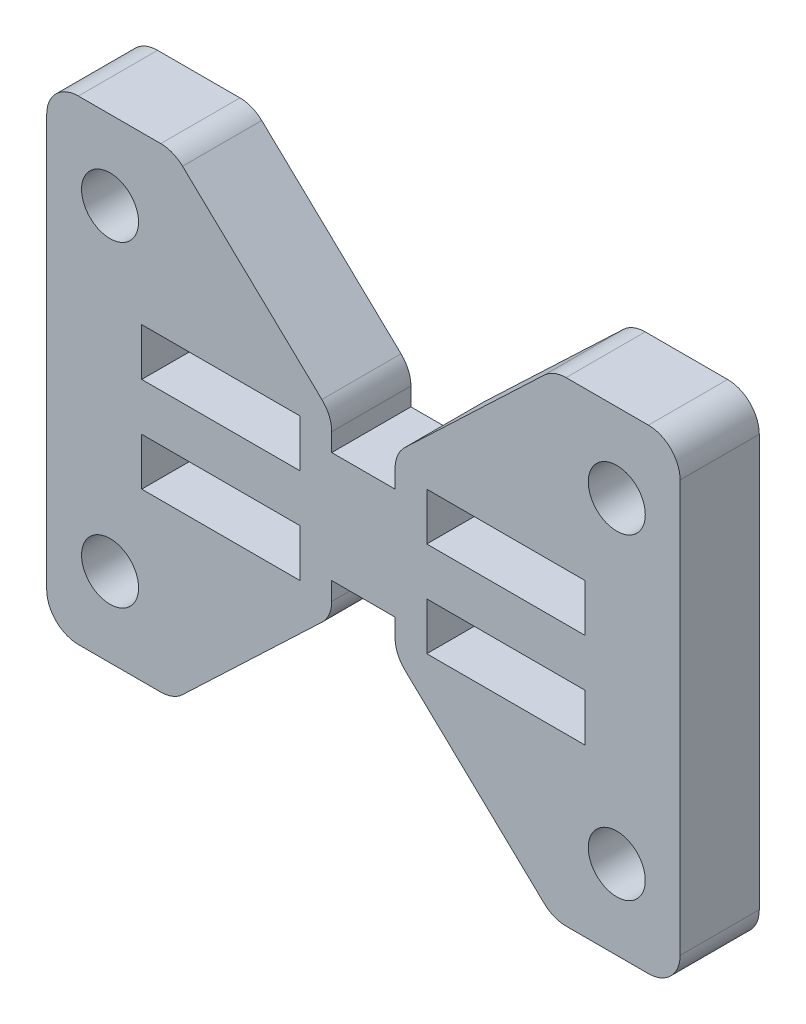
from build123d import *

# Parameters (mm, degrees)
SKETCH1_R           = 2.286
SKETCH1_W           = 12.7
SKETCH1_H           = 3.81
BOSS_EXTRUDE1_DEPTH = 3.175
FILLET1_R           = 2.54


with BuildPart() as part:
    # Sketch1 → Boss-Extrude1 (new, symmetric)
    with BuildSketch(Plane.XY):
        Polygon((-2.54, -4.445), (2.54, -4.445), (2.54, -6.985), (15.24, -19.05), (25.4, -19.05), (25.4, 19.05), (15.24, 19.05), (2.54, 6.985), (2.54, 4.445), (-2.54, 4.445), (-2.54, 6.985), (-15.24, 19.05), (-25.4, 19.05), (-25.4, -19.05), (-15.24, -19.05), (-2.54, -6.985), align=None)
        with Locations((-20.32, -12.7)):
            Circle(SKETCH1_R, mode=Mode.SUBTRACT)
        with Locations(Location((-20.32, 12.7, 0), (0, 0, 180))):
            Circle(SKETCH1_R, mode=Mode.SUBTRACT)
        with Locations((20.32, 12.7)):
            Circle(SKETCH1_R, mode=Mode.SUBTRACT)
        with Locations(Location((20.32, -12.7, 0), (0, 0, 180))):
            Circle(SKETCH1_R, mode=Mode.SUBTRACT)
        with Locations((-11.43, 3.81)):
            Rectangle(SKETCH1_W, SKETCH1_H, mode=Mode.SUBTRACT)
        with Locations((-11.43, -3.81)):
            Rectangle(SKETCH1_W, SKETCH1_H, mode=Mode.SUBTRACT)
        with Locations((11.43, -3.81)):
            Rectangle(SKETCH1_W, SKETCH1_H, mode=Mode.SUBTRACT)
        with Locations((11.43, 3.81)):
            Rectangle(SKETCH1_W, SKETCH1_H, mode=Mode.SUBTRACT)
    extrude(amount=BOSS_EXTRUDE1_DEPTH, both=True)

    # Fillet1
    fillet1_edges = [part.edges().sort_by_distance(p)[0] for p in [
        (-2.54, -6.985, 0),
        (-15.24, -19.05, 0),
        (-25.4, -19.05, 0),
        (-25.4, 19.05, 0),
        (-15.24, 19.05, 0),
        (-2.54, 6.985, 0),
        (2.54, 6.985, 0),
        (15.24, 19.05, 0),
        (25.4, 19.05, 0),
        (25.4, -19.05, 0),
        (15.24, -19.05, 0),
        (2.54, -6.985, 0),
    ]]
    fillet(fillet1_edges, radius=FILLET1_R)


solid = part.part
